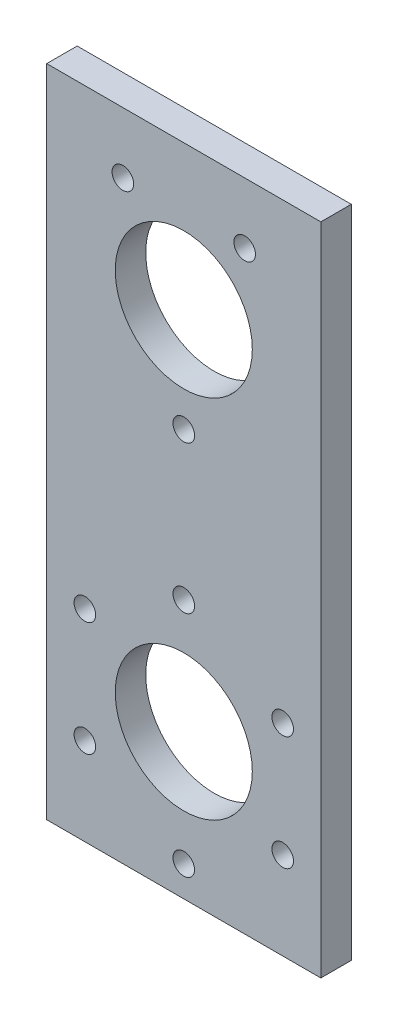
from build123d import *

# Parameters (mm, degrees)
SKETCH1_W             = 57.15
SKETCH1_H             = 136.525
SKETCH1_R             = 14.2875
BOSS_EXTRUDE1_DEPTH   = 3.175
F_8_CLEARANCE_HOLE1_D = 4.4958
F_8_CLEARANCE_HOLE2_D = 4.4958


with BuildPart() as part:
    # Sketch1 → Boss-Extrude1 (new, symmetric)
    with BuildSketch(Plane.XY):
        Rectangle(SKETCH1_W, SKETCH1_H)
        with Locations((0, 38.1)):
            Circle(SKETCH1_R, mode=Mode.SUBTRACT)
        with Locations((0, -38.1)):
            Circle(SKETCH1_R, mode=Mode.SUBTRACT)
    extrude(amount=BOSS_EXTRUDE1_DEPTH, both=True)

    # #8 Clearance Hole1 (through all)
    with Locations(Plane.XY.offset(3.175)):
        with Locations((0, -14.2875), (20.622229928, -26.19375), (20.622229928, -50.00625), (0, -61.9125), (-20.622229928, -50.00625), (-20.622229928, -26.19375), (0, -38.1)):
            Hole(F_8_CLEARANCE_HOLE1_D / 2)

    # #8 Clearance Hole2 (through all)
    with Locations(Plane.XY.offset(3.175)):
        with Locations((-12.7, 55.5625), (12.7, 55.5625), (0, 16.51)):
            Hole(F_8_CLEARANCE_HOLE2_D / 2)


solid = part.part
